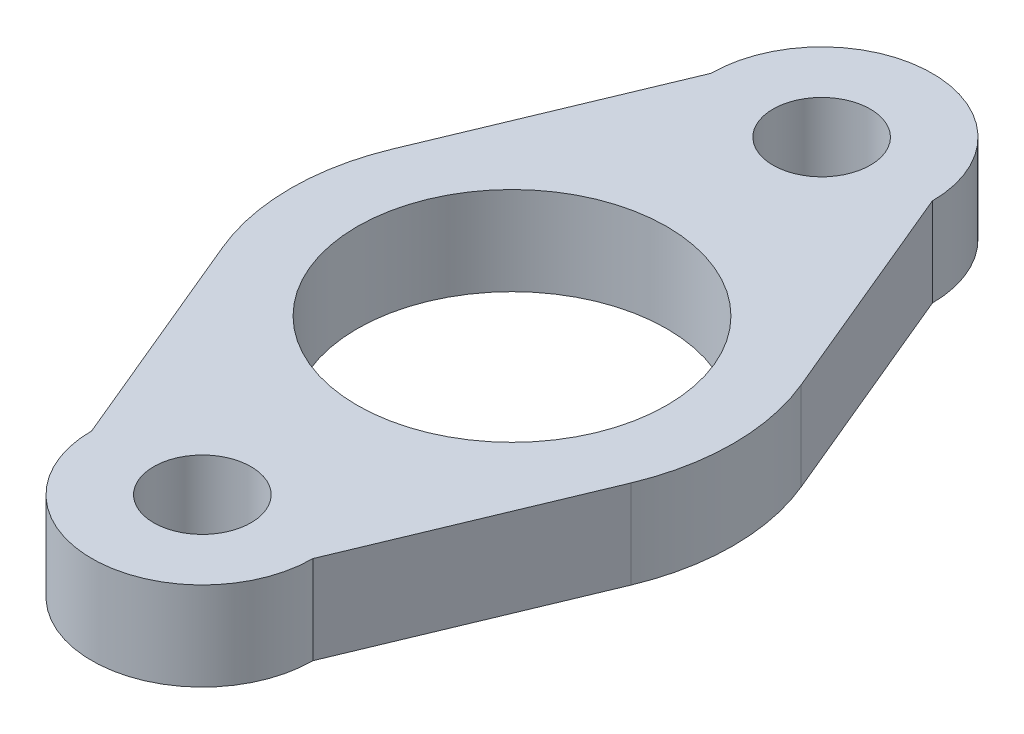
from build123d import *

# Parameters (mm, degrees)
SKETCH2_R           = 20
SKETCH2_R_2         = 5.5
SKETCH2_R_3         = 17.5
BOSS_EXTRUDE3_DEPTH = 10


with BuildPart() as part:
    # Sketch2 → Boss-Extrude3 (new body)
    # profile 1 of 2: a face of its own
    with BuildSketch(Plane(origin=(0, 0, 0), x_dir=(1, 0, 0), z_dir=(0, 1, 0))):
        with BuildLine():
            Line((-12.5, 35), (-23.076923077, 9.615384615))
            ThreePointArc((-23.076923077, 9.615384615), (-25, 0), (-23.076923077, -9.615384615))
            Line((-23.076923077, -9.615384615), (-12.5, -35))
            ThreePointArc((-12.5, -35), (0, -47.5), (12.5, -35))
            Line((12.5, -35), (23.076923077, -9.615384615))
            ThreePointArc((23.076923077, -9.615384615), (25, 0), (23.076923077, 9.615384615))
            Line((23.076923077, 9.615384615), (12.5, 35))
            ThreePointArc((12.5, 35), (0, 47.5), (-12.5, 35))
        make_face()
        Circle(SKETCH2_R, mode=Mode.SUBTRACT)
        with Locations(Location((0, 35, 0), (0, 0, 270))):
            Circle(SKETCH2_R_2, mode=Mode.SUBTRACT)
        with Locations(Location((0, -35, 0), (0, 0, 270))):
            Circle(SKETCH2_R_2, mode=Mode.SUBTRACT)
    # profile 2 of 2: a face of its own
    with BuildSketch(Plane(origin=(0, 0, 0), x_dir=(1, 0, 0), z_dir=(0, 1, 0))):
        Circle(SKETCH2_R)
        with Locations(Location((0, 0, 0), (0, 0, 270))):
            Circle(SKETCH2_R_3, mode=Mode.SUBTRACT)
    extrude(amount=BOSS_EXTRUDE3_DEPTH)


solid = part.part
